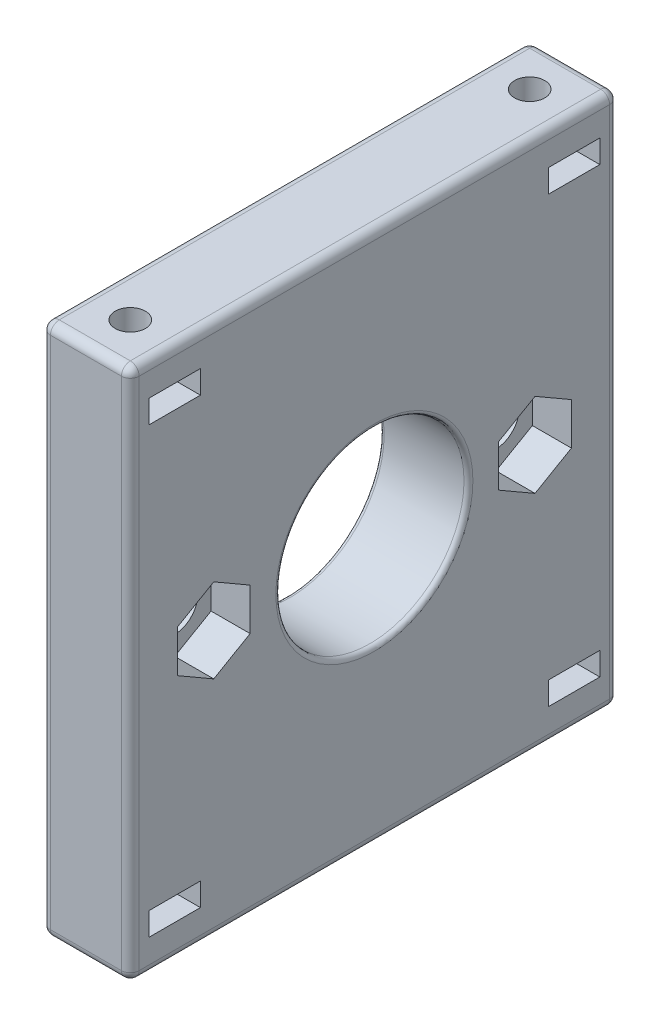
from build123d import *

# Parameters (mm, degrees)
SKETCH1_W           = 55
SKETCH1_H           = 60
BOSS_EXTRUDE1_DEPTH = 10
SKETCH2_R           = 1.7
CUT_EXTRUDE1_DEPTH  = 10
CUT_EXTRUDE2_START  = -10
SKETCH3_R           = 1.7
CUT_EXTRUDE2_DEPTH  = 10
SKETCH4_W           = 5.8
SKETCH4_H           = 2.6
CUT_EXTRUDE3_DEPTH  = 9
SKETCH6_R           = 2.6
SKETCH6_R_2         = 10.6
CUT_EXTRUDE4_DEPTH  = 15
FILLET1_R           = 1
FILLET2_R           = 0.5
CUT_EXTRUDE5_DEPTH  = 4.4


with BuildPart() as part:
    # Sketch1 → Boss-Extrude1 (new body)
    with BuildSketch(Plane(origin=(0, 0, 0), x_dir=(0, 0, -1), z_dir=(1, 0, 0))):
        Rectangle(SKETCH1_W, SKETCH1_H)
    extrude(amount=BOSS_EXTRUDE1_DEPTH)

    # Sketch2 → Cut-Extrude1 (cut)
    with BuildSketch(Plane.XZ.offset(30)):
        with Locations(Location((5, 22.5, 0), (0, 0, 270))):
            Circle(SKETCH2_R)
        with Locations(Location((5, -22.5, 0), (0, 0, 270))):
            Circle(SKETCH2_R)
    extrude(amount=-CUT_EXTRUDE1_DEPTH, mode=Mode.SUBTRACT)

    # Sketch3 → Cut-Extrude2 (cut)
    with BuildSketch(Plane(origin=(0, 30, 0), x_dir=(1, 0, 0), z_dir=(0, 1, 0)).offset(CUT_EXTRUDE2_START)):
        with Locations(Location((5, 22.5, 0), (0, 0, 90))):
            Circle(SKETCH3_R)
        with Locations(Location((5, -22.5, 0), (0, 0, 90))):
            Circle(SKETCH3_R)
    extrude(amount=CUT_EXTRUDE2_DEPTH, mode=Mode.SUBTRACT)

    # Sketch4 → Cut-Extrude3 (cut)
    with BuildSketch(Plane(origin=(10, 0, 0), x_dir=(0, 0, -1), z_dir=(1, 0, 0))):
        with Locations((-22.5, 25)):
            Rectangle(SKETCH4_W, SKETCH4_H)
        with Locations((22.5, 25)):
            Rectangle(SKETCH4_W, SKETCH4_H)
        with Locations((-22.5, -25)):
            Rectangle(SKETCH4_W, SKETCH4_H)
        with Locations((22.5, -25)):
            Rectangle(SKETCH4_W, SKETCH4_H)
    extrude(amount=-CUT_EXTRUDE3_DEPTH, mode=Mode.SUBTRACT)

    # Sketch6 → Cut-Extrude4 (cut)
    with BuildSketch(Plane(origin=(10, 0, 0), x_dir=(0, 0, -1), z_dir=(1, 0, 0))):
        with Locations((-18.1, 0)):
            Circle(SKETCH6_R)
        with Locations((18.1, 0)):
            Circle(SKETCH6_R)
        Circle(SKETCH6_R_2)
    extrude(amount=-CUT_EXTRUDE4_DEPTH, mode=Mode.SUBTRACT)

    # Fillet1
    fillet1_edges = [part.edges().sort_by_distance(p)[0] for p in [
        (10, 0, 27.5),
        (10, -30, 0),
        (10, 0, -27.5),
        (0, -30, 0),
        (0, 0, 27.5),
        (0, 30, 0),
        (0, 0, -27.5),
        (5, -30, -27.5),
        (5, -30, 27.5),
        (5, 30, 27.5),
        (5, 30, -27.5),
        (10, 30, 0),
    ]]
    fillet(fillet1_edges, radius=FILLET1_R)

    # Fillet2
    fillet2_edges = [part.edges().sort_by_distance(p)[0] for p in [
        (0, 0, 20.7),
        (10, 0, 20.7),
        (0, 0, -15.5),
        (10, 0, -15.5),
        (0, 0, 10.6),
        (10, 0, 10.6),
    ]]
    fillet(fillet2_edges, radius=FILLET2_R)

    # Sketch7 → Cut-Extrude5 (cut)
    with BuildSketch(Plane(origin=(10, 0, 0), x_dir=(0, 0, -1), z_dir=(1, 0, 0))):
        Polygon((-18.1, -4.734272207), (-14, -2.367136104), (-14, 2.367136104), (-18.1, 4.734272207), (-22.2, 2.367136104), (-22.2, -2.367136104), align=None)
        Polygon((18.1, -4.734272207), (22.2, -2.367136104), (22.2, 2.367136104), (18.1, 4.734272207), (14, 2.367136104), (14, -2.367136104), align=None)
    extrude(amount=-CUT_EXTRUDE5_DEPTH, mode=Mode.SUBTRACT)


solid = part.part
